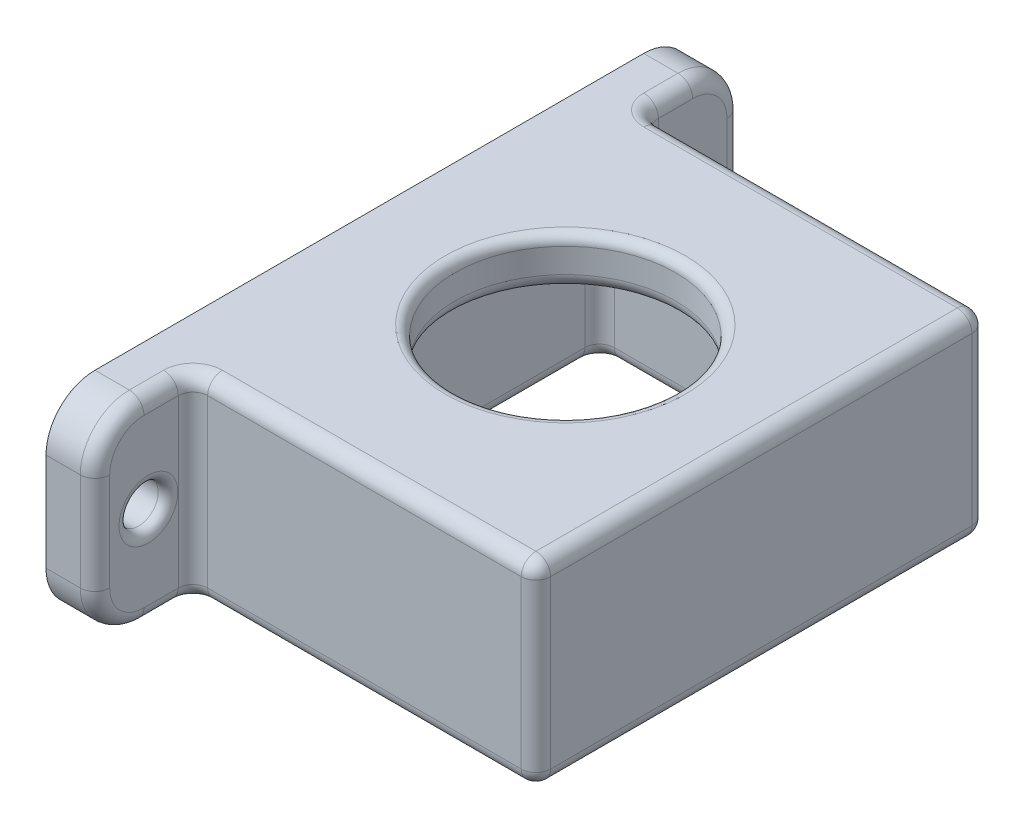
from build123d import *

# Parameters (mm, degrees)
SKETCH2_W           = 40
SKETCH2_H           = 46
SKETCH2_W_2         = 31
SKETCH2_H_2         = 38
BOSS_EXTRUDE1_DEPTH = 15
SKETCH4_W           = 40
SKETCH4_H           = 46
BOSS_EXTRUDE2_DEPTH = 5
SKETCH5_R           = 11.25
CUT_EXTRUDE1_DEPTH  = 5
SKETCH8_W           = 5
SKETCH8_H           = 20
BOSS_EXTRUDE3_DEPTH = 10
FILLET2_R           = 5
SKETCH9_R           = 2
CUT_EXTRUDE2_DEPTH  = 26
FILLET3_R           = 1.5
FILLET4_R           = 1


with BuildPart() as part:
    # Sketch2 → Boss-Extrude1 (new body)
    with BuildSketch(Plane(origin=(0, 0, 0), x_dir=(1, 0, 0), z_dir=(0, 1, 0))):
        Rectangle(SKETCH2_W, SKETCH2_H)
        Rectangle(SKETCH2_W_2, SKETCH2_H_2, mode=Mode.SUBTRACT)
    extrude(amount=BOSS_EXTRUDE1_DEPTH)

    # Sketch4 → Boss-Extrude2 (add)
    with BuildSketch(Plane(origin=(0, 15, 0), x_dir=(1, 0, 0), z_dir=(0, 1, 0))):
        Rectangle(SKETCH4_W, SKETCH4_H)
    extrude(amount=BOSS_EXTRUDE2_DEPTH)

    # Sketch5 → Cut-Extrude1 (cut)
    with BuildSketch(Plane(origin=(0, 20, 0), x_dir=(1, 0, 0), z_dir=(0, 1, 0))):
        with Locations(Location((0, 0, 0), (0, 0, 270))):
            Circle(SKETCH5_R)
    extrude(amount=-CUT_EXTRUDE1_DEPTH, mode=Mode.SUBTRACT)

    # Sketch8 → Boss-Extrude3 (add)
    with BuildSketch(Plane.XY.offset(23)):
        with Locations((-17.5, 10)):
            Rectangle(SKETCH8_W, SKETCH8_H)
    boss_extrude3 = extrude(amount=BOSS_EXTRUDE3_DEPTH)

    # Mirror1: Boss-Extrude3 across plane
    add(boss_extrude3.mirror(Plane.XY))

    # Fillet2
    fillet2_edges = [part.edges().sort_by_distance(p)[0] for p in [
        (-17.5, 0, 33),
        (-17.5, 20, 33),
        (-17.5, 20, -33),
        (-17.5, 0, -33),
    ]]
    fillet(fillet2_edges, radius=FILLET2_R)

    # Sketch9 → Cut-Extrude2 (cut)
    with BuildSketch(Plane(origin=(0, 0, 0), x_dir=(0, 0, -1), z_dir=(1, 0, 0))):
        with Locations((-27.550924627, 10)):
            Circle(SKETCH9_R)
        with Locations((27.550924627, 10)):
            Circle(SKETCH9_R)
    extrude(amount=-CUT_EXTRUDE2_DEPTH, mode=Mode.SUBTRACT)

    # Fillet3
    fillet3_edges = [part.edges().sort_by_distance(p)[0] for p in [
        (15.5, 0, 0),
        (15.5, 7.5, 19),
        (0, 0, -19),
        (15.5, 7.5, -19),
        (-15.5, 0, 0),
        (-15.5, 7.5, -19),
        (0, 0, 19),
        (-15.5, 7.5, 19),
        (15.5, 15, 0),
        (0, 15, -19),
        (-15.5, 15, 0),
        (0, 15, 19),
        (20, 20, 0),
        (2.5, 20, -23),
        (0, 15, -11.25),
        (2.5, 0, 23),
        (2.5, 20, 23),
        (-15, 10, 23),
        (2.5, 0, -23),
        (20, 0, 0),
        (-15, 10, -23),
        (-15, 0, 25.5),
        (-15, 0, -25.5),
        (-15, 10, -33),
        (-15, 20, -25.5),
        (20, 10, 23),
        (-15, 18.535533906, -31.535533906),
        (-15, 1.464466094, -31.535533906),
        (20, 10, -23),
        (-15, 20, 25.5),
        (-15, 10, 33),
        (-15, 18.535533906, 31.535533906),
        (-15, 1.464466094, 31.535533906),
    ]]
    fillet(fillet3_edges, radius=FILLET3_R)

    # Fillet4
    fillet4_edges = [part.edges().sort_by_distance(p)[0] for p in [
        (-15, 10, 29.550924627),
        (-20, 10, 29.550924627),
        (-20, 10, -25.550924627),
        (-15, 10, -25.550924627),
        (0, 20, -11.25),
    ]]
    fillet(fillet4_edges, radius=FILLET4_R)


solid = part.part
